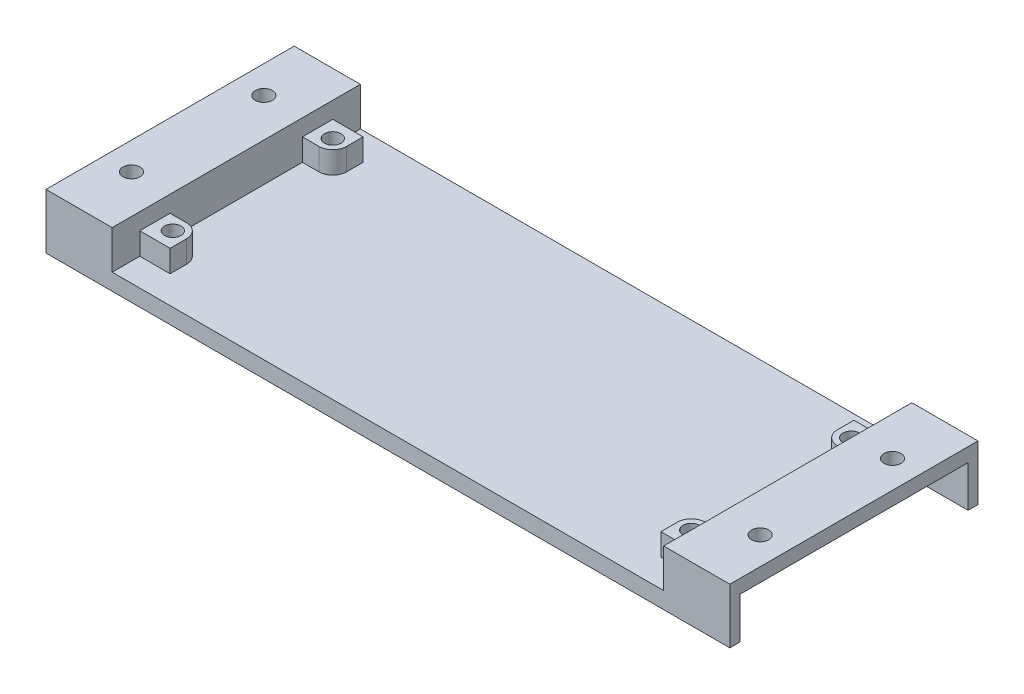
from build123d import *

# Parameters (mm, degrees)
SKETCH2_W           = 124
SKETCH2_H           = 45
BOSS_EXTRUDE3_DEPTH = 10
SKETCH4_W           = 100
SKETCH4_H           = 45
CUT_EXTRUDE1_DEPTH  = 7
CUT_EXTRUDE2_REACH  = 68.71
SKETCH5_R           = 1.55
SKETCH6_W           = 10.2
SKETCH6_H           = 41.4
CUT_EXTRUDE3_DEPTH  = 7.5
SKETCH7_R           = 1.5
BOSS_EXTRUDE4_DEPTH = 4


with BuildPart() as part:
    # Sketch2 → Boss-Extrude3 (new body)
    with BuildSketch(Plane(origin=(0, 0, 0), x_dir=(1, 0, 0), z_dir=(0, 1, 0))):
        Rectangle(SKETCH2_W, SKETCH2_H)
    extrude(amount=BOSS_EXTRUDE3_DEPTH)

    # Sketch4 → Cut-Extrude1 (cut)
    with BuildSketch(Plane(origin=(0, 10, 0), x_dir=(1, 0, 0), z_dir=(0, 1, 0))):
        Rectangle(SKETCH4_W, SKETCH4_H)
    extrude(amount=-CUT_EXTRUDE1_DEPTH, mode=Mode.SUBTRACT)

    # Sketch5 → Cut-Extrude2 (cut, up to next)
    with BuildSketch(Plane(origin=(0, 10, 0), x_dir=(1, 0, 0), z_dir=(0, 1, 0)), mode=Mode.PRIVATE) as cut_extrude2_sk1:
        with Locations(Location((-57, 12, 0), (0, 0, 270))):
            Circle(SKETCH5_R)
    cut_extrude2_tool1 = extrude(cut_extrude2_sk1.sketch, amount=-CUT_EXTRUDE2_REACH, mode=Mode.PRIVATE) & part.part
    # Sketch5 → Cut-Extrude2 (cut, up to next)
    with BuildSketch(Plane(origin=(0, 10, 0), x_dir=(1, 0, 0), z_dir=(0, 1, 0)), mode=Mode.PRIVATE) as cut_extrude2_sk2:
        with Locations(Location((-57, -12, 0), (0, 0, 270))):
            Circle(SKETCH5_R)
    cut_extrude2_tool2 = extrude(cut_extrude2_sk2.sketch, amount=-CUT_EXTRUDE2_REACH, mode=Mode.PRIVATE) & part.part
    # Sketch5 → Cut-Extrude2 (cut, up to next)
    with BuildSketch(Plane(origin=(0, 10, 0), x_dir=(1, 0, 0), z_dir=(0, 1, 0)), mode=Mode.PRIVATE) as cut_extrude2_sk3:
        with Locations(Location((57, -12, 0), (0, 0, 270))):
            Circle(SKETCH5_R)
    cut_extrude2_tool3 = extrude(cut_extrude2_sk3.sketch, amount=-CUT_EXTRUDE2_REACH, mode=Mode.PRIVATE) & part.part
    # Sketch5 → Cut-Extrude2 (cut, up to next)
    with BuildSketch(Plane(origin=(0, 10, 0), x_dir=(1, 0, 0), z_dir=(0, 1, 0)), mode=Mode.PRIVATE) as cut_extrude2_sk4:
        with Locations(Location((57, 12, 0), (0, 0, 270))):
            Circle(SKETCH5_R)
    cut_extrude2_tool4 = extrude(cut_extrude2_sk4.sketch, amount=-CUT_EXTRUDE2_REACH, mode=Mode.PRIVATE) & part.part
    add(cut_extrude2_tool1.solids().sort_by_distance((-57, 10, -12))[0], mode=Mode.SUBTRACT)
    add(cut_extrude2_tool2.solids().sort_by_distance((-57, 10, 12))[0], mode=Mode.SUBTRACT)
    add(cut_extrude2_tool3.solids().sort_by_distance((57, 10, 12))[0], mode=Mode.SUBTRACT)
    add(cut_extrude2_tool4.solids().sort_by_distance((57, 10, -12))[0], mode=Mode.SUBTRACT)

    # Sketch6 → Cut-Extrude3 (cut)
    with BuildSketch(Plane.XZ):
        with Locations((-56.9, 0)):
            Rectangle(SKETCH6_W, SKETCH6_H)
        with Locations((56.9, 0)):
            Rectangle(SKETCH6_W, SKETCH6_H)
    extrude(amount=-CUT_EXTRUDE3_DEPTH, mode=Mode.SUBTRACT)

    # Sketch7 → Boss-Extrude4 (add)
    # profile 1 of 4: a face of its own
    with BuildSketch(Plane(origin=(0, 3, 0), x_dir=(1, 0, 0), z_dir=(0, 1, 0))):
        with BuildLine():
            Line((-50, -17.5), (-44.5, -17.5))
            Line((-44.5, -17.5), (-44.5, -14.5))
            ThreePointArc((-44.5, -14.5), (-45.232233047, -12.732233047), (-47, -12))
            Line((-47, -12), (-50, -12))
            Line((-50, -12), (-50, -17.5))
        make_face()
        with Locations(Location((-47, -14.5, 0), (0, 0, 270))):
            Circle(SKETCH7_R, mode=Mode.SUBTRACT)
    # profile 2 of 4: a face of its own
    with BuildSketch(Plane(origin=(0, 3, 0), x_dir=(1, 0, 0), z_dir=(0, 1, 0))):
        with BuildLine():
            Line((44.5, -14.5), (44.5, -17.5))
            Line((44.5, -17.5), (50, -17.5))
            Line((50, -17.5), (50, -12))
            Line((50, -12), (47, -12))
            ThreePointArc((47, -12), (45.232233047, -12.732233047), (44.5, -14.5))
        make_face()
        with Locations(Location((47, -14.5, 0), (0, 0, 270))):
            Circle(SKETCH7_R, mode=Mode.SUBTRACT)
    # profile 3 of 4: a face of its own
    with BuildSketch(Plane(origin=(0, 3, 0), x_dir=(1, 0, 0), z_dir=(0, 1, 0))):
        with BuildLine():
            Line((-50, 17.5), (-50, 12))
            Line((-50, 12), (-47, 12))
            ThreePointArc((-47, 12), (-45.232233047, 12.732233047), (-44.5, 14.5))
            Line((-44.5, 14.5), (-44.5, 17.5))
            Line((-44.5, 17.5), (-50, 17.5))
        make_face()
        with Locations(Location((-47, 14.5, 0), (0, 0, 270))):
            Circle(SKETCH7_R, mode=Mode.SUBTRACT)
    # profile 4 of 4: a face of its own
    with BuildSketch(Plane(origin=(0, 3, 0), x_dir=(1, 0, 0), z_dir=(0, 1, 0))):
        with BuildLine():
            Line((47, 12), (50, 12))
            Line((50, 12), (50, 17.5))
            Line((50, 17.5), (44.5, 17.5))
            Line((44.5, 17.5), (44.5, 14.5))
            ThreePointArc((44.5, 14.5), (45.232233047, 12.732233047), (47, 12))
        make_face()
        with Locations(Location((47, 14.5, 0), (0, 0, 270))):
            Circle(SKETCH7_R, mode=Mode.SUBTRACT)
    extrude(amount=BOSS_EXTRUDE4_DEPTH)


solid = part.part
